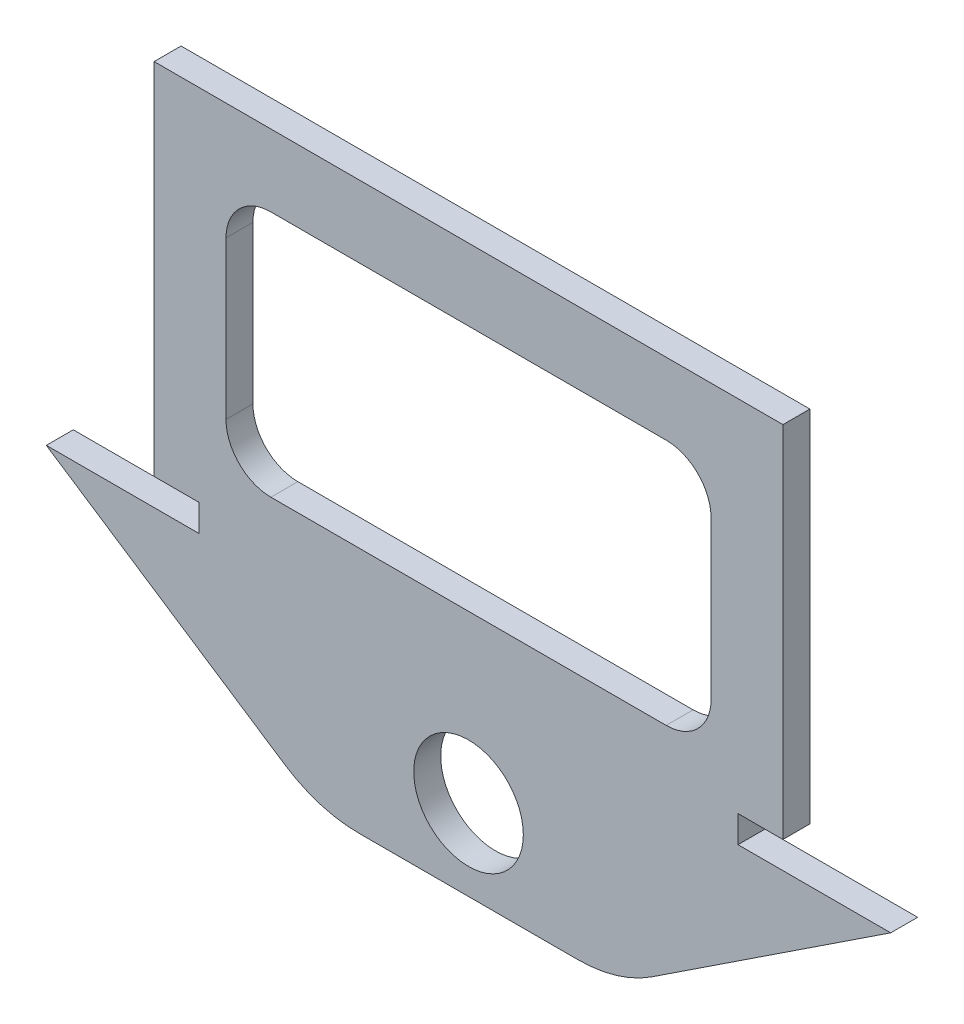
from build123d import *

# Parameters (mm, degrees)
ESBO_O1_R                = 12.2
RESSALTO_EXTRUS_O1_DEPTH = 6


with BuildPart() as part:
    # Esboço1 → Ressalto-extrusão1 (new body)
    with BuildSketch(Plane.XY):
        with BuildLine():
            Line((-94, 0), (-60, 0))
            Line((-60, 0), (-60, 6))
            Line((-60, 6), (-70, 6))
            Line((-70, 6), (-70, 86))
            Line((-70, 86), (70, 86))
            Line((70, 86), (70, 6))
            Line((70, 6), (60, 6))
            Line((60, 6), (60, 0))
            Line((60, 0), (94, 0))
            Line((94, 0), (40.861662232, -35.044161486))
            ThreePointArc((40.861662232, -35.044161486), (32.967231691, -38.734342211), (24.345307444, -40))
            Line((24.345307444, -40), (-24.345307444, -40))
            ThreePointArc((-24.345307444, -40), (-32.967231691, -38.734342211), (-40.861662232, -35.044161486))
            Line((-40.861662232, -35.044161486), (-94, 0))
        make_face()
        with Locations((0, -22)):
            Circle(ESBO_O1_R, mode=Mode.SUBTRACT)
        with BuildLine():
            Line((54, 60), (54, 25))
            ThreePointArc((54, 25), (51.071067812, 17.928932188), (44, 15))
            Line((44, 15), (-44, 15))
            ThreePointArc((-44, 15), (-51.071067812, 17.928932188), (-54, 25))
            Line((-54, 25), (-54, 60))
            ThreePointArc((-54, 60), (-51.071067812, 67.071067812), (-44, 70))
            Line((-44, 70), (44, 70))
            ThreePointArc((44, 70), (51.071067812, 67.071067812), (54, 60))
        make_face(mode=Mode.SUBTRACT)
    extrude(amount=RESSALTO_EXTRUS_O1_DEPTH)


solid = part.part
